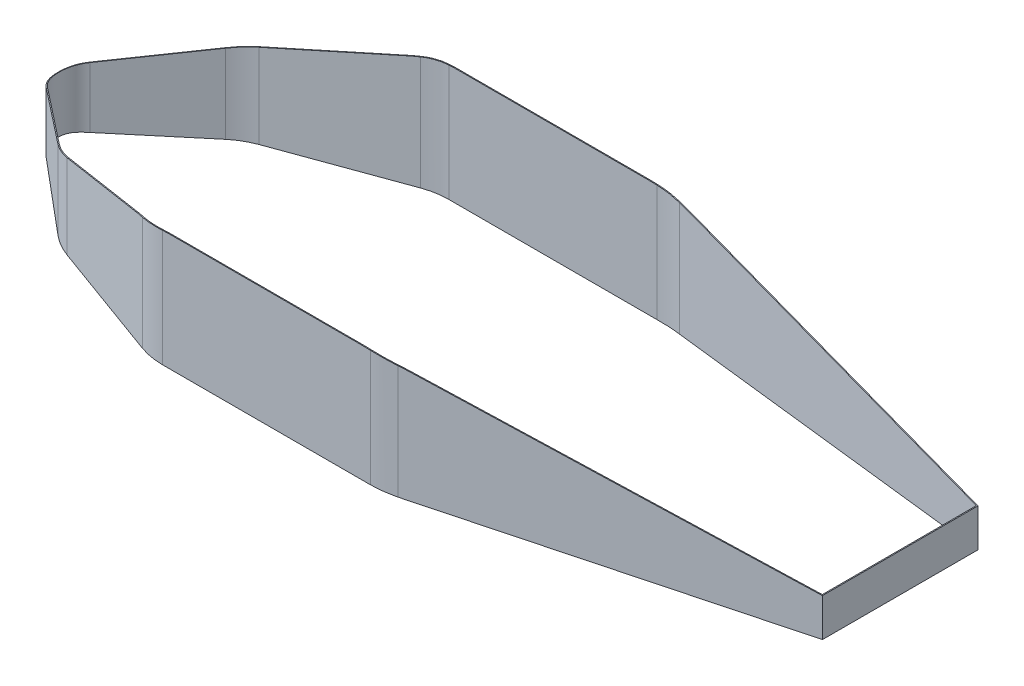
from build123d import *

# Parameters (mm, degrees)
TOPVIEW_EXTRUDE_DEPTH      = 800
SHELL1_T                   = -5
SIDEPROFILE_CUT_DEPTH      = 4914.47877429
SIDEPROFILE_CUT_DEPTH_BACK = 4914.47877429
SKETCH2_OUTSIDE_W          = 5698.923
SKETCH2_OUTSIDE_H          = 1806.388


with BuildPart() as part:
    # Sketch1 → TopView_Extrude (new body)
    with BuildSketch(Plane(origin=(0, 0, 0), x_dir=(1, 0, 0), z_dir=(0, 1, 0))):
        with BuildLine():
            Line((146.069849076, 122.567124227), (556.148324977, 466.663731547))
            ThreePointArc((556.148324977, 466.663731547), (613.263316637, 506.656075273), (676.455195963, 536.122941687))
            Line((676.455195963, 536.122941687), (1335.173700718, 775.877020708))
            ThreePointArc((1335.173700718, 775.877020708), (1402.522523085, 793.923094197), (1471.981833896, 800))
            Line((1471.981833896, 800), (2631.460091708, 800))
            ThreePointArc((2631.460091708, 800), (2701.184663634, 796.955760422), (2770.378589806, 787.846210174))
            Line((2770.378589806, 787.846210174), (4781.451, 433.24))
            Line((4781.451, 433.24), (4781.451, -433.24))
            Line((4781.451, -433.24), (2770.378589806, -787.846210174))
            ThreePointArc((2770.378589806, -787.846210174), (2701.184663634, -796.955760422), (2631.460091708, -800))
            Line((2631.460091708, -800), (1471.981833896, -800))
            ThreePointArc((1471.981833896, -800), (1402.522523085, -793.923094197), (1335.173700718, -775.877020708))
            Line((1335.173700718, -775.877020708), (676.455195963, -536.122941687))
            ThreePointArc((676.455195963, -536.122941687), (613.263316637, -506.656075273), (556.148324977, -466.663731547))
            Line((556.148324977, -466.663731547), (146.069849076, -122.567124227))
            ThreePointArc((146.069849076, -122.567124227), (88.915850742, 0), (146.069849076, 122.567124227))
        make_face()
    extrude(amount=TOPVIEW_EXTRUDE_DEPTH)

    # Shell1
    shell1_openings = [part.faces().sort_by_distance(p)[0] for p in [
        (2472.186486347, 0, 0),
        (2472.186486347, 800, 0),
    ]]
    offset(amount=SHELL1_T, openings=shell1_openings, kind=Kind.INTERSECTION)

    # Sketch2 outside → SideProfile_Cut (cut, two sides: drawn at the far end of the back side and taken through both)
    with BuildSketch(Plane.XY.offset(-SIDEPROFILE_CUT_DEPTH_BACK)):
        with Locations((2435.1835, 400)):
            Rectangle(SKETCH2_OUTSIDE_W, SKETCH2_OUTSIDE_H)
        with BuildLine():
            Line((0, 300), (0, 332.854125267))
            ThreePointArc((0, 332.854125267), (31.780430043, 425.180358155), (113.65511039, 478.384359237))
            Line((113.65511039, 478.384359237), (1282.133703367, 770.201559797))
            ThreePointArc((1282.133703367, 770.201559797), (1402.370605908, 792.522432945), (1524.432967436, 800))
            Line((1524.432967436, 800), (2561.597345878, 800))
            ThreePointArc((2561.597345878, 800), (2701.110323381, 795.128098421), (2839.943607388, 780.536129108))
            Line((2839.943607388, 780.536129108), (4781.451, 507.675))
            Line((4781.451, 507.675), (4781.451, 295.448))
            Line((4781.451, 295.448), (2805.958277636, 157.307872364))
            ThreePointArc((2805.958277636, 157.307872364), (2701.387181329, 151.827524732), (2596.688525433, 150))
            Line((2596.688525433, 150), (150, 150))
            ThreePointArc((150, 150), (43.933982822, 193.933982822), (0, 300))
        make_face(mode=Mode.SUBTRACT)
    extrude(amount=SIDEPROFILE_CUT_DEPTH + SIDEPROFILE_CUT_DEPTH_BACK, mode=Mode.SUBTRACT)


solid = part.part
